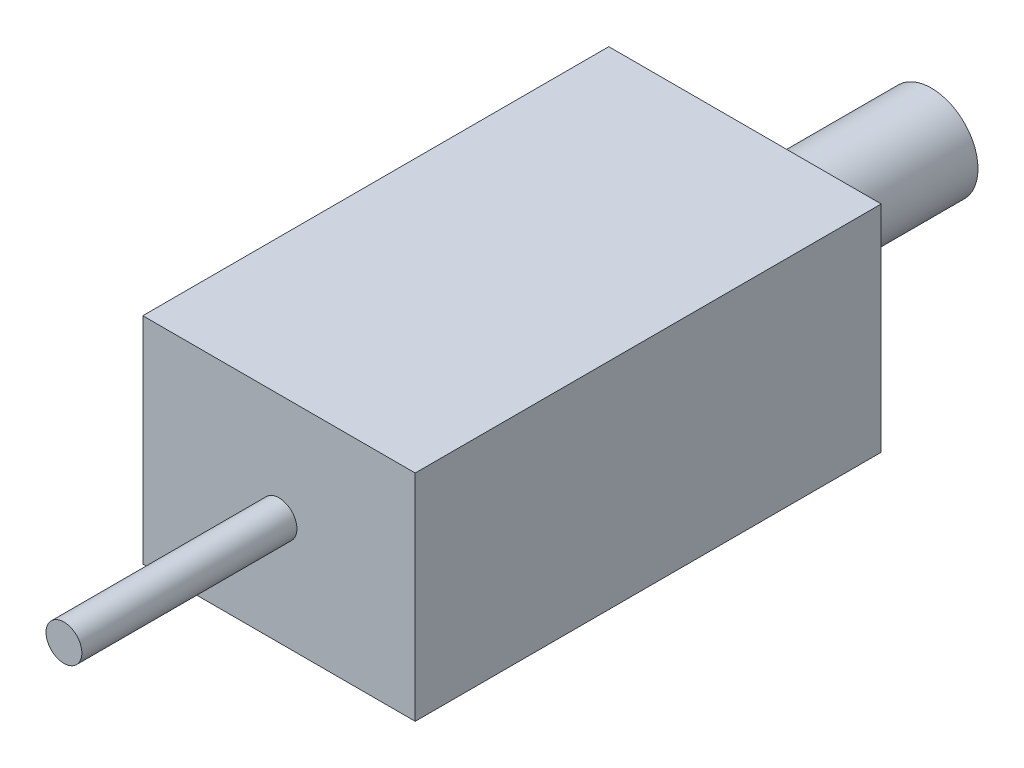
from build123d import *

# Parameters (mm, degrees)
SKETCH1_W           = 38
SKETCH1_H           = 30
BOSS_EXTRUDE1_DEPTH = 65
SKETCH2_R           = 2.5
BOSS_EXTRUDE2_DEPTH = 30
SKETCH3_R           = 6.5
BOSS_EXTRUDE3_DEPTH = 26


with BuildPart() as part:
    # Sketch1 → Boss-Extrude1 (new body)
    with BuildSketch(Plane.XY):
        Rectangle(SKETCH1_W, SKETCH1_H)
    extrude(amount=BOSS_EXTRUDE1_DEPTH)

    # Sketch2 → Boss-Extrude2 (add)
    with BuildSketch(Plane.XY.offset(65)):
        with Locations(Location((0, 0, 0), (0, 0, 180))):
            Circle(SKETCH2_R)
    extrude(amount=BOSS_EXTRUDE2_DEPTH)

    # Sketch3 → Boss-Extrude3 (add)
    with BuildSketch(Plane(origin=(0, 0, 0), x_dir=(-1, 0, 0), z_dir=(0, 0, -1))):
        with Locations(Location((0, 0, 0), (0, 0, 180))):
            Circle(SKETCH3_R)
    extrude(amount=BOSS_EXTRUDE3_DEPTH)


solid = part.part
